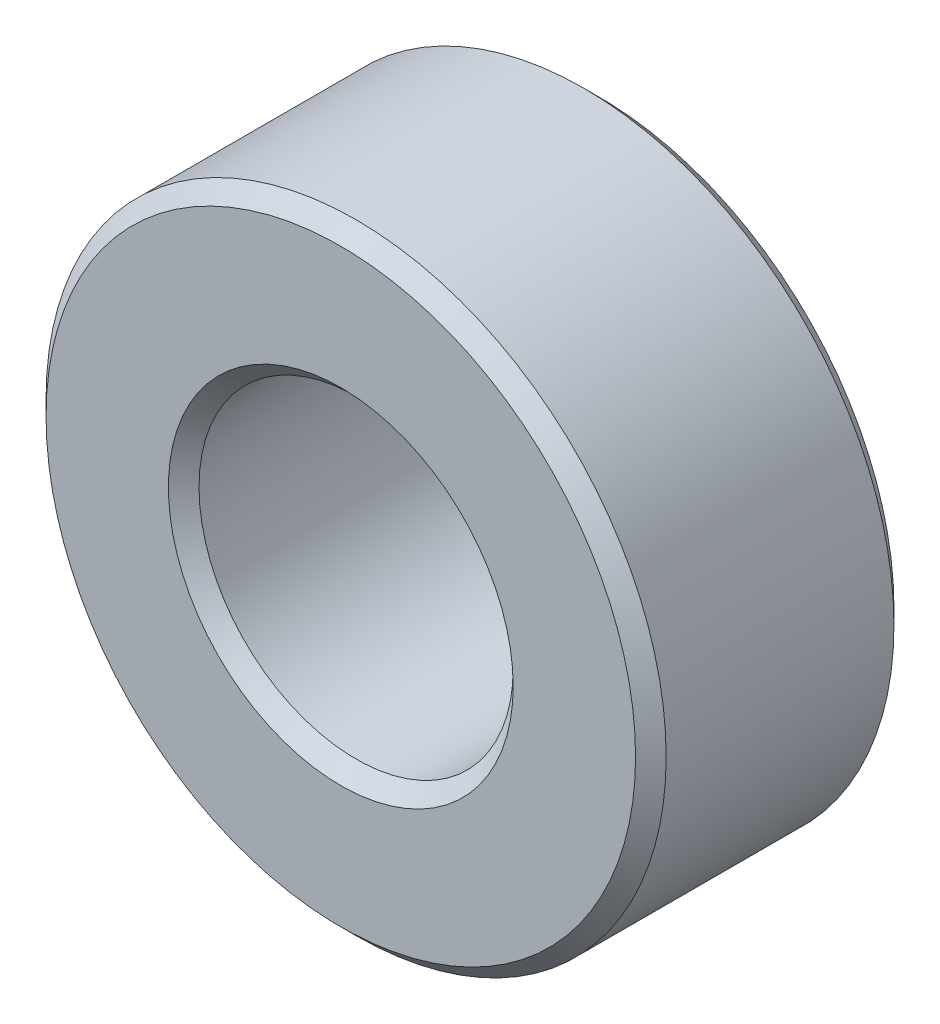
from build123d import *

# Parameters (mm, degrees)
BOSS_EXTRUDE1_DEPTH      = 3.96875
BOSS_EXTRUDE1_DEPTH_BACK = 3.96875
SKETCH3_R                = 9.525
SKETCH3_R_2              = 4.826
CHAMFER1_SIZE            = 0.4699


with BuildPart() as part:
    # Sketch3 → Boss-Extrude1 (new, two sides: drawn at the far end of the back side and taken through both)
    with BuildSketch(Plane.XY.offset(-BOSS_EXTRUDE1_DEPTH_BACK)):
        Circle(SKETCH3_R)
        Circle(SKETCH3_R_2, mode=Mode.SUBTRACT)
    extrude(amount=BOSS_EXTRUDE1_DEPTH + BOSS_EXTRUDE1_DEPTH_BACK)

    # Chamfer1
    chamfer1_edges = [part.edges().sort_by_distance(p)[0] for p in [
        (-9.525, 0, -3.96875),
        (-4.826, 0, -3.96875),
        (-9.525, 0, 3.96875),
        (-4.826, 0, 3.96875),
    ]]
    chamfer(chamfer1_edges, length=CHAMFER1_SIZE)


solid = part.part
